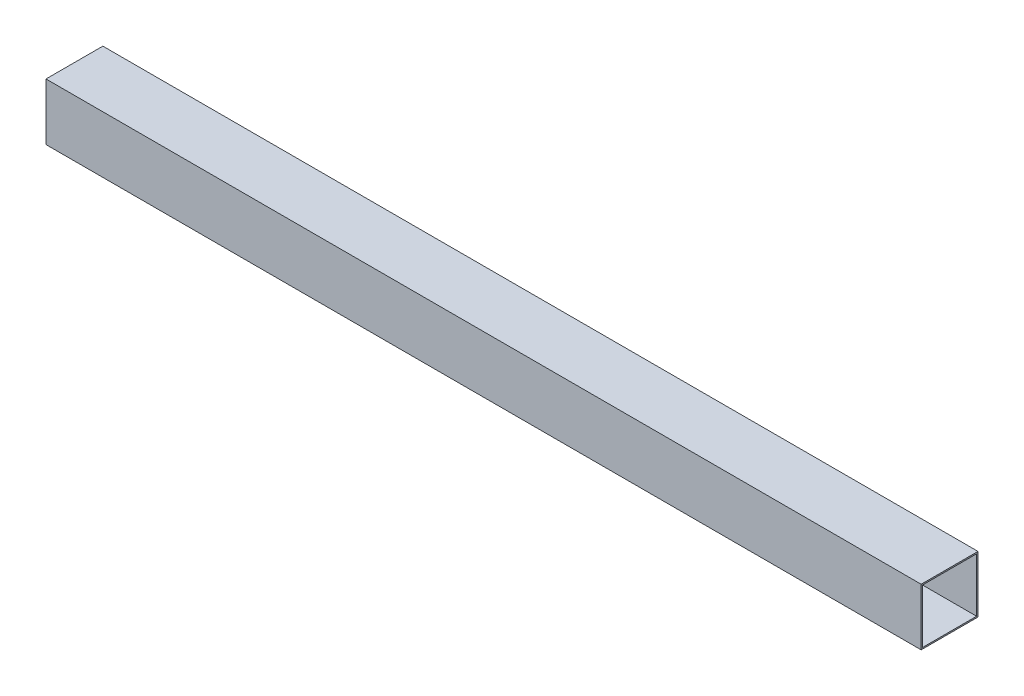
from build123d import *

# Parameters (mm, degrees)
SKETCH1_W                              = 50.8
SKETCH1_H                              = 50.8
SKETCH1_W_2                            = 48.3108
SKETCH1_H_2                            = 48.3108
AL_TUBE_SQUARE_2_SQ_X_049_WALL_1_DEPTH = 782


with BuildPart() as part:
    # Sketch1 → Al tube (square) 2 SQ X .049 WALL(1) (new body)
    with BuildSketch(Plane.YZ):
        Rectangle(SKETCH1_W, SKETCH1_H)
        Rectangle(SKETCH1_W_2, SKETCH1_H_2, mode=Mode.SUBTRACT)
    extrude(amount=AL_TUBE_SQUARE_2_SQ_X_049_WALL_1_DEPTH)


solid = part.part
